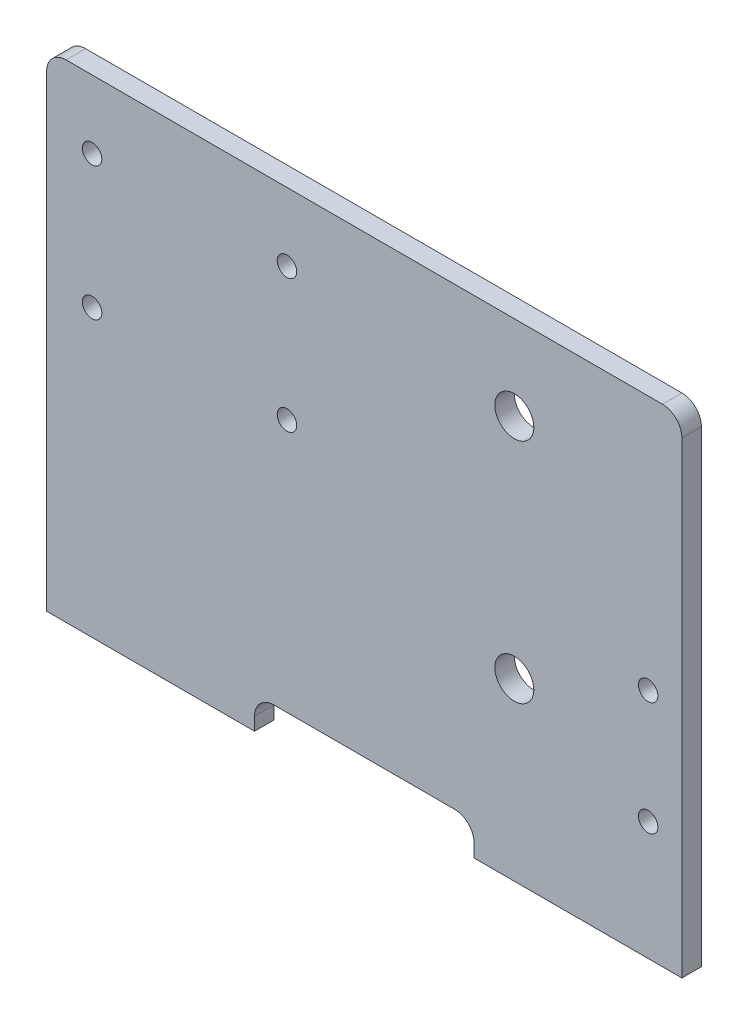
from build123d import *

# Parameters (mm, degrees)
CROQUIS1_W              = 97.8
CROQUIS1_H              = 75
CROQUIS1_R              = 1.5
CROQUIS1_R_2            = 3
SALIENTE_EXTRUIR1_DEPTH = 1.5
CROQUIS2_W              = 33.8
CROQUIS2_H              = 5
CORTAR_EXTRUIR1_DEPTH   = 62.696515299
REDONDEO1_R             = 3


with BuildPart() as part:
    # Croquis1 → Saliente-Extruir1 (new, symmetric)
    with BuildSketch(Plane.XY):
        Rectangle(CROQUIS1_W, CROQUIS1_H)
        with Locations((-41.9, 27)):
            Circle(CROQUIS1_R, mode=Mode.SUBTRACT)
        with Locations((-11.9, 27)):
            Circle(CROQUIS1_R, mode=Mode.SUBTRACT)
        with Locations((-11.9, 6.5)):
            Circle(CROQUIS1_R, mode=Mode.SUBTRACT)
        with Locations((-41.9, 6.5)):
            Circle(CROQUIS1_R, mode=Mode.SUBTRACT)
        with Locations((23.1, -10.5)):
            Circle(CROQUIS1_R_2, mode=Mode.SUBTRACT)
        with Locations((23.1, 24.5)):
            Circle(CROQUIS1_R_2, mode=Mode.SUBTRACT)
        with Locations((43.7, -1.75)):
            Circle(CROQUIS1_R, mode=Mode.SUBTRACT)
        with Locations((43.7, -19.25)):
            Circle(CROQUIS1_R, mode=Mode.SUBTRACT)
    extrude(amount=SALIENTE_EXTRUIR1_DEPTH, both=True)

    # Croquis2 → Cortar-Extruir1 (cut, through all)
    with BuildSketch(Plane.XY.offset(1.5)):
        with Locations((0, -35)):
            Rectangle(CROQUIS2_W, CROQUIS2_H)
    extrude(amount=-CORTAR_EXTRUIR1_DEPTH, mode=Mode.SUBTRACT)

    # Redondeo1
    redondeo1_edges = [part.edges().sort_by_distance(p)[0] for p in [
        (16.9, -32.5, 0),
        (-16.9, -32.5, 0),
        (-48.9, 37.5, 0),
        (48.9, 37.5, 0),
    ]]
    fillet(redondeo1_edges, radius=REDONDEO1_R)


solid = part.part
